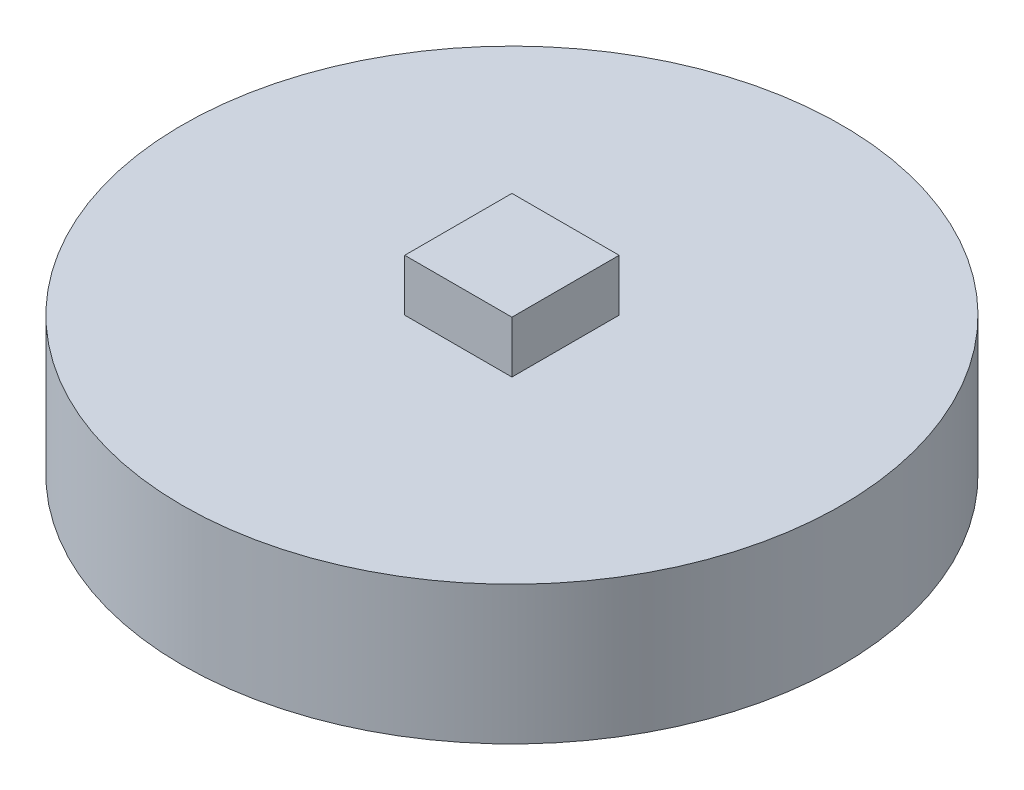
from build123d import *

# Parameters (mm, degrees)
ESQUISSE1_R        = 19.06
BOSS_EXTRU_1_DEPTH = 8
BOSS_EXTRU_2_DEPTH = 3


with BuildPart() as part:
    # Esquisse1 → Boss.-Extru.1 (new body)
    with BuildSketch(Plane(origin=(0, 0, 0), x_dir=(1, 0, 0), z_dir=(0, 1, 0))):
        with Locations(Location((0, 0, 0), (0, 0, 270))):
            Circle(ESQUISSE1_R)
    extrude(amount=BOSS_EXTRU_1_DEPTH)

    # Esquisse2 → Boss.-Extru.2 (add)
    with BuildSketch(Plane(origin=(0, 8, 0), x_dir=(1, 0, 0), z_dir=(0, 1, 0))):
        Polygon((0, 3.1), (3.1, 3.1), (3.1, -3.1), (-3.1, -3.1), (-3.1, 3.1), align=None)
    extrude(amount=BOSS_EXTRU_2_DEPTH)


solid = part.part
